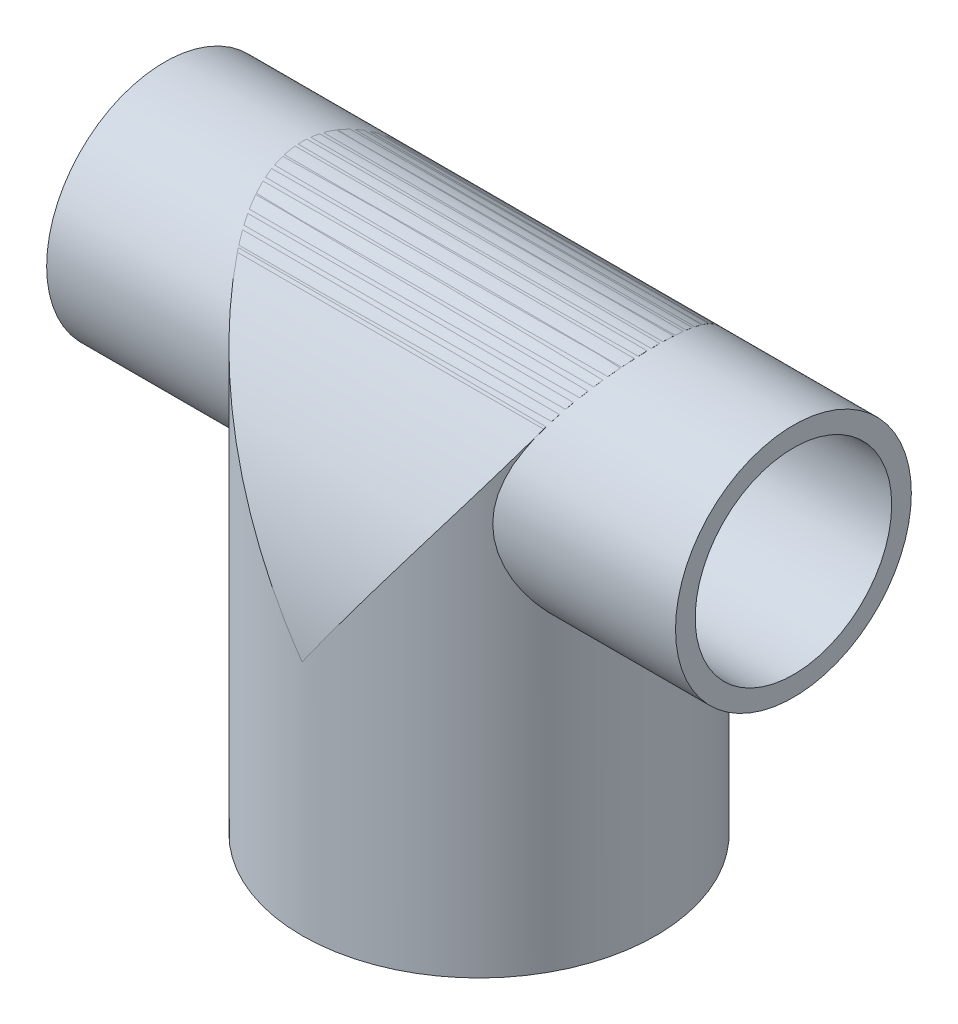
from build123d import *

# Parameters (mm, degrees)
SKETCH_1_R          = 6
SKETCH_1_R_2        = 5
EXTRUDE_1_DEPTH     = 16
SKETCH_3_R          = 9
EXTRUDE_2_DEPTH     = 26
SKETCH_4_R          = 8
CUT_EXTRUDE_1_DEPTH = 14
SKETCH_6_R          = 5
CUT_EXTRUDE_2_DEPTH = 12.5
CUT_EXTRUDE_3_DEPTH = 12.5


with BuildPart() as part:
    # 草图1 → 凸台-拉伸1 (new, symmetric)
    with BuildSketch(Plane(origin=(0, 0, 0), x_dir=(0, 0, -1), z_dir=(1, 0, 0))):
        Circle(SKETCH_1_R)
        Circle(SKETCH_1_R_2, mode=Mode.SUBTRACT)
    extrude(amount=EXTRUDE_1_DEPTH, both=True)


with BuildPart() as body_2:
    # 草图3 → 凸台-拉伸2 (new body)
    with BuildSketch(Plane(origin=(0, 6, 0), x_dir=(1, 0, 0), z_dir=(0, 1, 0))):
        with Locations(Location((0, 0, 0), (0, 0, 270))):
            Circle(SKETCH_3_R)
    extrude(amount=-EXTRUDE_2_DEPTH)

    # 草图4 → 切除-拉伸1 (cut)
    with BuildSketch(Plane(origin=(0, -20, 0), x_dir=(-1, 0, 0), z_dir=(0, -1, 0))):
        with Locations(Location((0, 0, 0), (0, 0, 90))):
            Circle(SKETCH_4_R)
    extrude(amount=-CUT_EXTRUDE_1_DEPTH, mode=Mode.SUBTRACT)

    # 草图6 → 切除-拉伸2 (cut, symmetric)
    with BuildSketch(Plane(origin=(0, 0, 0), x_dir=(0, 0, -1), z_dir=(1, 0, 0))):
        Circle(SKETCH_6_R)
    extrude(amount=CUT_EXTRUDE_2_DEPTH, both=True, mode=Mode.SUBTRACT)

    # 草图7 → 切除-拉伸3 (cut, symmetric)
    with BuildSketch(Plane(origin=(0, 0, 0), x_dir=(0, 0, -1), z_dir=(1, 0, 0))):
        with BuildLine():
            Line((9, 8), (9, -7.937253933))
            ThreePointArc((9, -7.937253933), (7.83745824, -1.573292903), (4.5, 3.968626967))
            ThreePointArc((4.5, 3.968626967), (0, 6), (-4.5, 3.968626967))
            ThreePointArc((-4.5, 3.968626967), (-7.83745824, -1.573292903), (-9, -7.937253933))
            Line((-9, -7.937253933), (-9, 8))
            Line((-9, 8), (9, 8))
        make_face()
    extrude(amount=CUT_EXTRUDE_3_DEPTH, both=True, mode=Mode.SUBTRACT)


solid = Compound([part.part, body_2.part])
